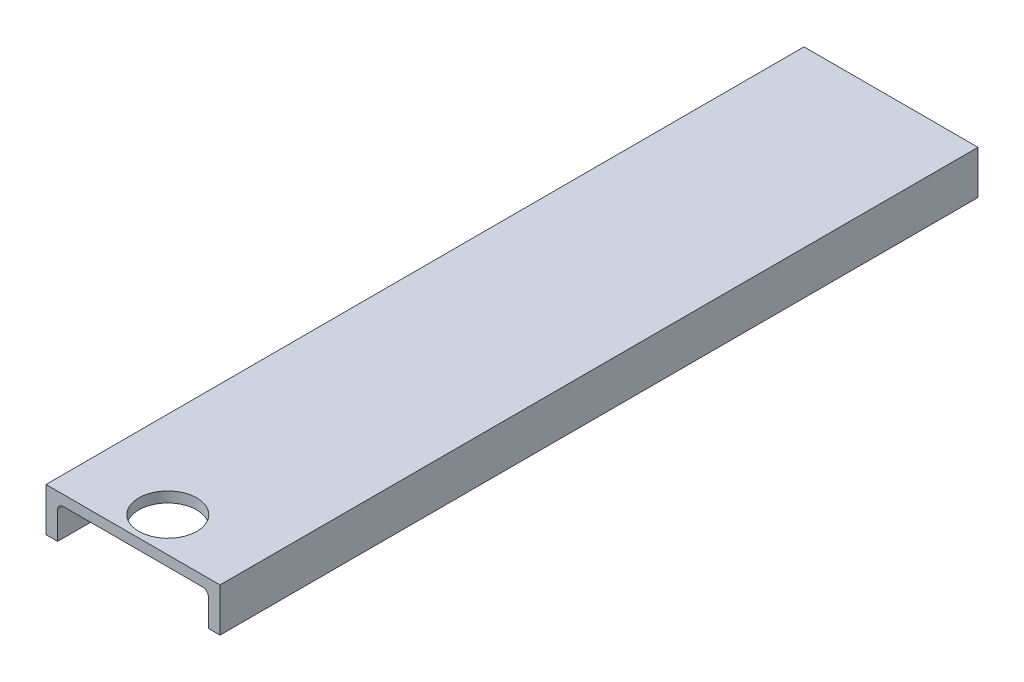
from build123d import *

# Parameters (mm, degrees)
BOSS_EXTRUDE1_DEPTH = 331.978
FILLET1_R           = 2.54
FILLET2_R           = 2.54
SKETCH2_R           = 12.7
CUT_EXTRUDE1_DEPTH  = 335.699723609


with BuildPart() as part:
    # Sketch1 → Boss-Extrude1 (new body)
    with BuildSketch(Plane.XY):
        Polygon((0, 0), (38.1, 0), (38.1, -19.05), (33.02, -19.05), (33.02, -4.572), (-33.02, -4.572), (-33.02, -19.05), (-38.1, -19.05), (-38.1, 0), align=None)
    extrude(amount=BOSS_EXTRUDE1_DEPTH)

    # Fillet1
    fillet1_edges = [part.edges().sort_by_distance(p)[0] for p in [
        (-33.02, -4.572, 165.989),
    ]]
    fillet(fillet1_edges, radius=FILLET1_R)

    # Fillet2
    fillet2_edges = [part.edges().sort_by_distance(p)[0] for p in [
        (33.02, -4.572, 165.989),
    ]]
    fillet(fillet2_edges, radius=FILLET2_R)

    # Sketch2 → Cut-Extrude1 (cut, through all)
    with BuildSketch(Plane(origin=(0, 0, 0), x_dir=(1, 0, 0), z_dir=(0, 1, 0))):
        with Locations(Location((0, -316.738, 0), (0, 0, 270))):
            Circle(SKETCH2_R)
    extrude(amount=-CUT_EXTRUDE1_DEPTH, mode=Mode.SUBTRACT)


solid = part.part
